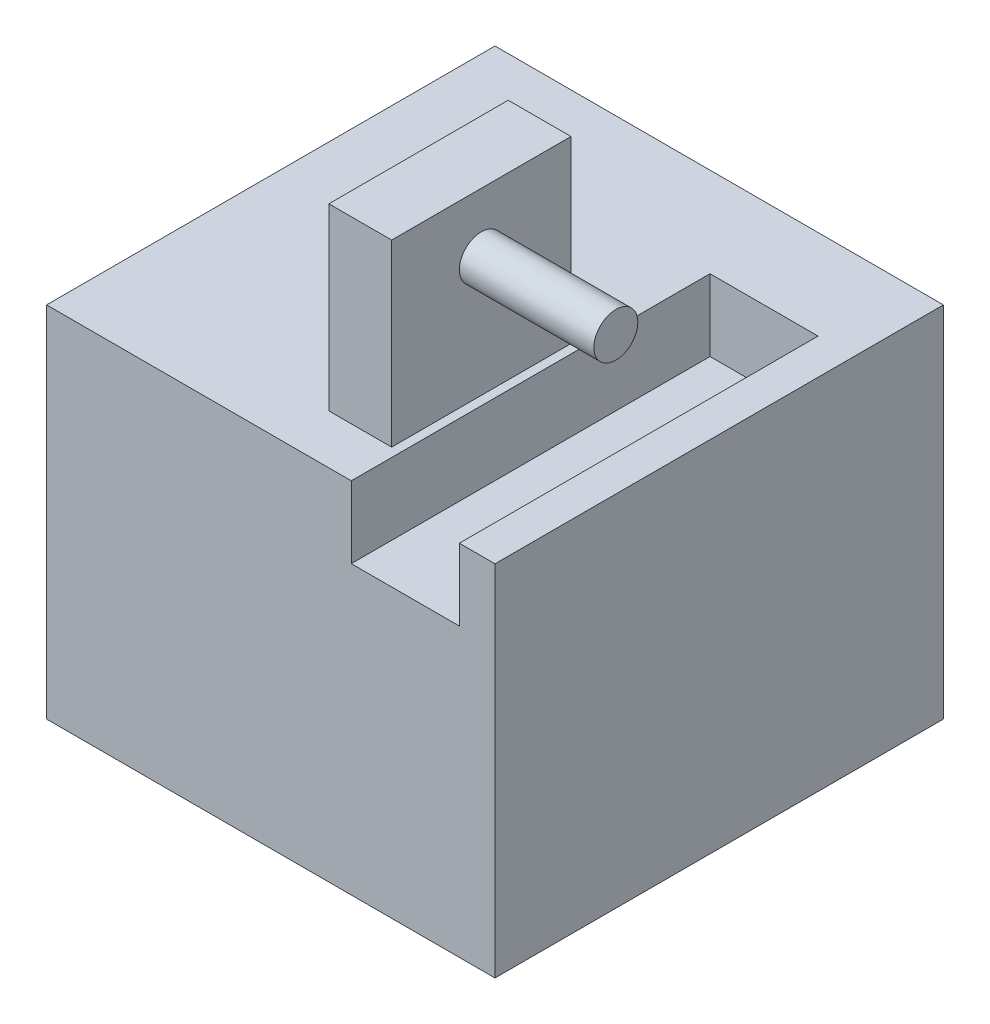
from build123d import *

# Parameters (mm, degrees)
SKETCH1_W           = 80
SKETCH1_H           = 80
BOSS_EXTRUDE1_DEPTH = 40
SKETCH2_W           = 12.05
SKETCH2_H           = 80
CUT_EXTRUDE1_DEPTH  = 8
SKETCH3_W           = 7
SKETCH3_H           = 20
BOSS_EXTRUDE2_DEPTH = 20
SKETCH4_R           = 2.45
BOSS_EXTRUDE3_DEPTH = 15
SKETCH6_W           = 80
SKETCH6_H           = 40
CUT_EXTRUDE3_DEPTH  = 30
SKETCH7_W           = 50
SKETCH7_H           = 40
CUT_EXTRUDE4_DEPTH  = 30
SKETCH8_W           = 12.05
SKETCH8_H           = 10
BOSS_EXTRUDE4_DEPTH = 8


with BuildPart() as part:
    # Sketch1 → Boss-Extrude1 (new body)
    with BuildSketch(Plane(origin=(0, 0, 0), x_dir=(1, 0, 0), z_dir=(0, 1, 0))):
        Rectangle(SKETCH1_W, SKETCH1_H)
    extrude(amount=BOSS_EXTRUDE1_DEPTH)

    # Sketch2 → Cut-Extrude1 (cut)
    with BuildSketch(Plane(origin=(0, 40, 0), x_dir=(1, 0, 0), z_dir=(0, 1, 0))):
        Rectangle(SKETCH2_W, SKETCH2_H)
    extrude(amount=-CUT_EXTRUDE1_DEPTH, mode=Mode.SUBTRACT)

    # Sketch3 → Boss-Extrude2 (add)
    with BuildSketch(Plane(origin=(0, 40, 0), x_dir=(1, 0, 0), z_dir=(0, 1, 0))):
        with Locations((-10.525, -24.5)):
            Rectangle(SKETCH3_W, SKETCH3_H)
    extrude(amount=BOSS_EXTRUDE2_DEPTH)

    # Sketch4 → Boss-Extrude3 (add)
    with BuildSketch(Plane(origin=(-7.025, 0, 0), x_dir=(0, 0, -1), z_dir=(1, 0, 0))):
        with Locations(Location((-24.5, 53.35, 0), (0, 0, 180))):
            Circle(SKETCH4_R)
    extrude(amount=BOSS_EXTRUDE3_DEPTH)

    # Sketch6 → Cut-Extrude3 (cut)
    with BuildSketch(Plane(origin=(0, 0, -40), x_dir=(-1, 0, 0), z_dir=(0, 0, -1))):
        with Locations((0, 20)):
            Rectangle(SKETCH6_W, SKETCH6_H)
    extrude(amount=-CUT_EXTRUDE3_DEPTH, mode=Mode.SUBTRACT)

    # Sketch7 → Cut-Extrude4 (cut)
    with BuildSketch(Plane(origin=(40, 0, 0), x_dir=(0, 0, -1), z_dir=(1, 0, 0))):
        with Locations((-15, 20)):
            Rectangle(SKETCH7_W, SKETCH7_H)
    extrude(amount=-CUT_EXTRUDE4_DEPTH, mode=Mode.SUBTRACT)

    # Sketch8 → Boss-Extrude4 (add)
    with BuildSketch(Plane(origin=(0, 32, 0), x_dir=(1, 0, 0), z_dir=(0, 1, 0))):
        with Locations((0, 5)):
            Rectangle(SKETCH8_W, SKETCH8_H)
    extrude(amount=BOSS_EXTRUDE4_DEPTH)


solid = part.part
